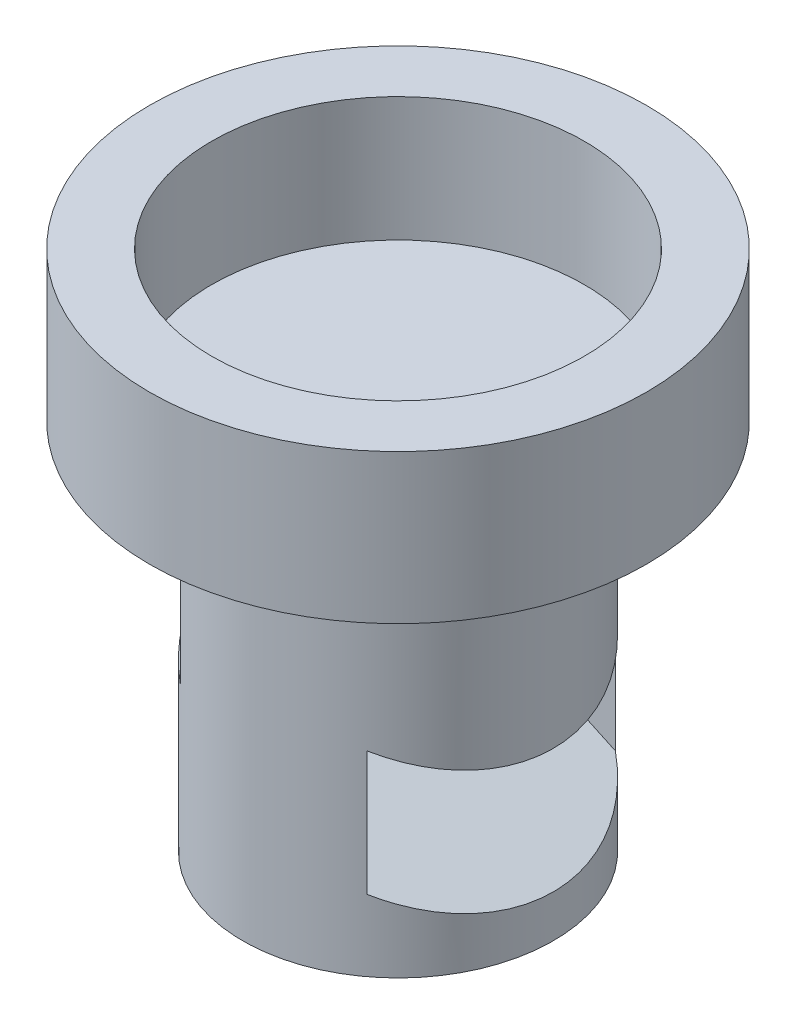
from build123d import *

# Parameters (mm, degrees)
CROQUIS1_R              = 20
CROQUIS1_R_2            = 15
SALIENTE_EXTRUIR1_DEPTH = 10
CROQUIS2_R              = 20
SALIENTE_EXTRUIR2_DEPTH = 2
CROQUIS3_R              = 12.5
SALIENTE_EXTRUIR3_DEPTH = 30
CORTAR_EXTRUIR2_DEPTH   = 10


with BuildPart() as part:
    # Croquis1 → Saliente-Extruir1 (new body)
    with BuildSketch(Plane(origin=(0, 0, 0), x_dir=(1, 0, 0), z_dir=(0, 1, 0))):
        with Locations(Location((0, 0, 0), (0, 0, 270))):
            Circle(CROQUIS1_R)
        with Locations(Location((0, 0, 0), (0, 0, 270))):
            Circle(CROQUIS1_R_2, mode=Mode.SUBTRACT)
    extrude(amount=-SALIENTE_EXTRUIR1_DEPTH)

    # Croquis2 → Saliente-Extruir2 (add)
    with BuildSketch(Plane.XZ.offset(10)):
        with Locations(Location((0, 0, 0), (0, 0, 90))):
            Circle(CROQUIS2_R)
    extrude(amount=SALIENTE_EXTRUIR2_DEPTH)

    # Croquis3 → Saliente-Extruir3 (add)
    with BuildSketch(Plane.XZ.offset(12)):
        with Locations(Location((0, 0, 0), (0, 0, 270))):
            Circle(CROQUIS3_R)
    extrude(amount=SALIENTE_EXTRUIR3_DEPTH)

    # Croquis4 → Cortar-Extruir2 (cut, symmetric)
    with BuildSketch(Plane.XY):
        Polygon((-15.546090629, -15.510770255), (-15.546090629, -25.510770255), (14.453909371, -39.5), (14.453909371, -29.5), align=None)
    extrude(amount=CORTAR_EXTRUIR2_DEPTH, both=True, mode=Mode.SUBTRACT)


solid = part.part
